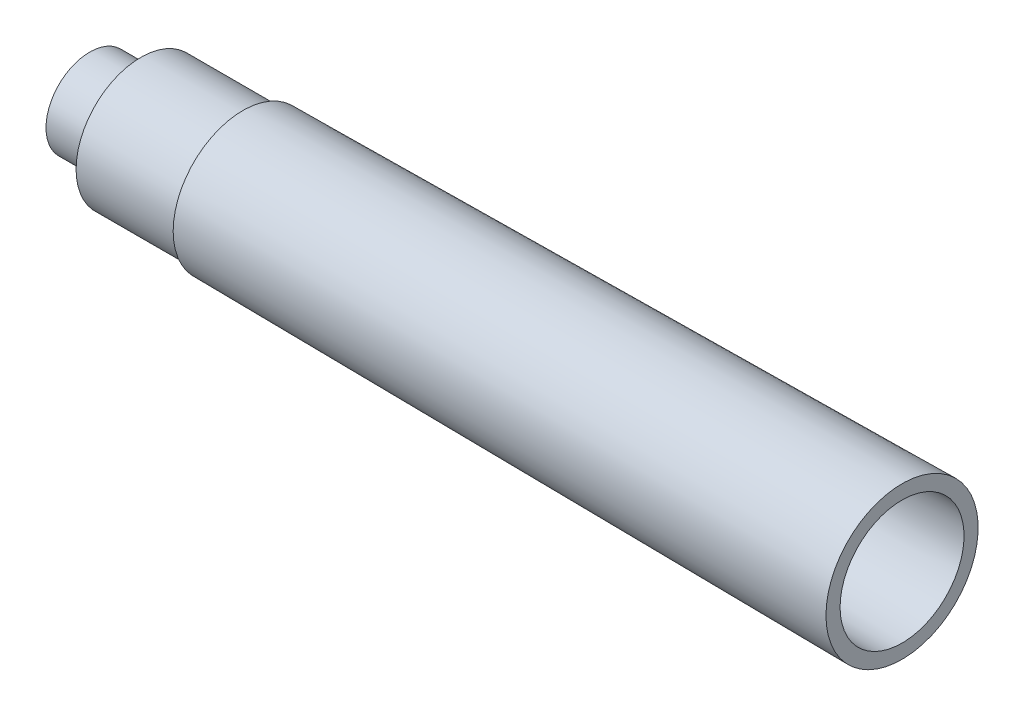
from build123d import *


with BuildPart() as part:
    # Esboço1 → Revolução1 (revolve)
    with BuildSketch(Plane.XY, mode=Mode.PRIVATE) as revolu_o1_sk:
        Polygon((0.465967208, 5.756230657), (2.565967208, 5.756230657), (3.000371133, 6.797789179), (8.065967208, 6.797789179), (8.065967208, 7.047789179), (40.765967208, 7.362789179), (40.765967208, 7.047789179), (40.765967208, 6.662789179), (8.765967208, 6.347789179), (8.765967208, 6.097789179), (7.343223511, 6.097789179), (3.466863641, 6.097789179), (2.910073766, 4.762789179), (2.246620738, 4.762789179), (0.88387569, 4.762789179), (0.88387569, 5.112789179), (2.246620738, 5.112789179), (2.246620738, 5.406230657), (0.465967208, 5.406230657), align=None)
    revolve(revolu_o1_sk.sketch.rotate(Axis((0.88387569, 3.587789179, 0), (1, 0, 0)), 90), axis=Axis((0.88387569, 3.587789179, 0), (1, 0, 0)))


solid = part.part
